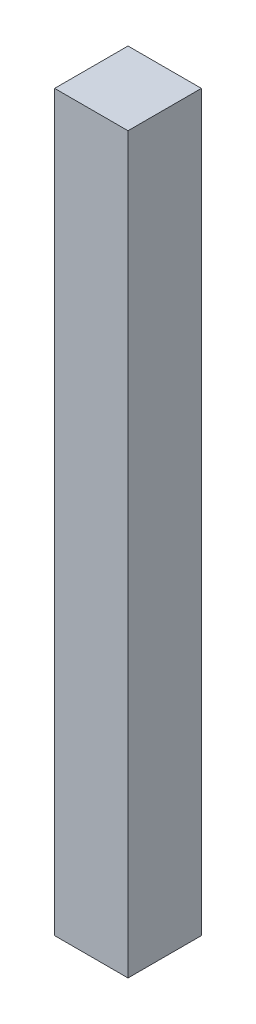
from build123d import *

# Parameters (mm, degrees)
SKETCH4_W           = 20
SKETCH4_H           = 20
BOSS_EXTRUDE2_DEPTH = 200


with BuildPart() as part:
    # Sketch4 → Boss-Extrude2 (new body)
    with BuildSketch(Plane(origin=(0, 0, 0), x_dir=(1, 0, 0), z_dir=(0, 1, 0))):
        with Locations((10, -10)):
            Rectangle(SKETCH4_W, SKETCH4_H)
    extrude(amount=BOSS_EXTRUDE2_DEPTH)


solid = part.part
